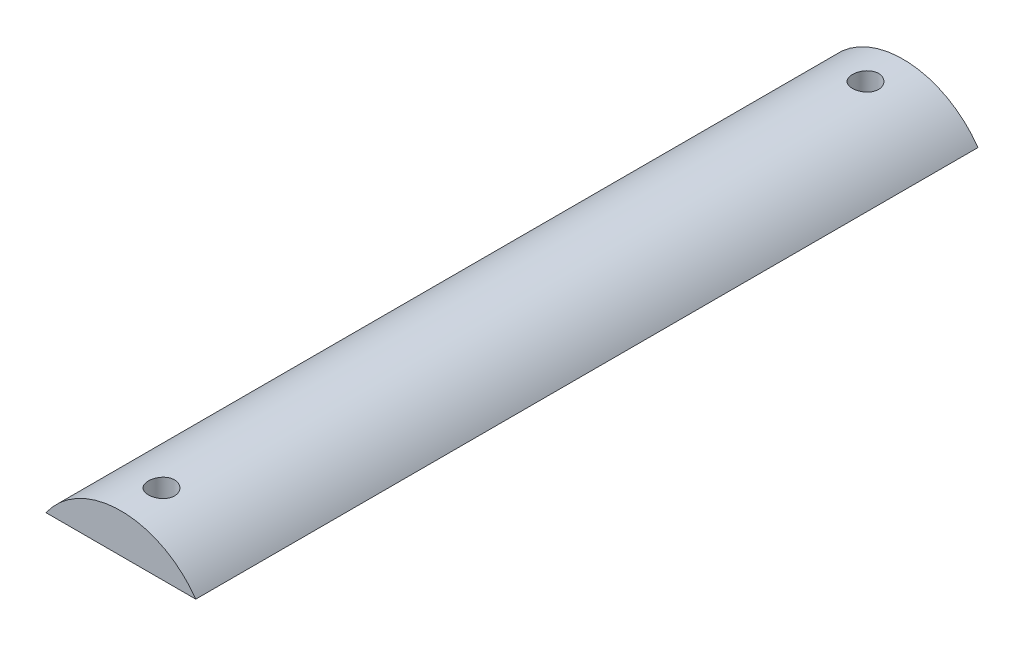
from build123d import *

# Parameters (mm, degrees)
BOSS_EXTRUDE1_DEPTH     = 60
CUT_EXTRUDE1_DEPTH      = 9
CUT_EXTRUDE1_DEPTH_BACK = 1
CUT_EXTRUDE2_DEPTH      = 61.307545133
CUT_EXTRUDE2_DEPTH_BACK = 61.307545133
SKETCH3_R               = 1


with BuildPart() as part:
    # Sketch1 → Boss-Extrude1 (new body)
    with BuildSketch(Plane.XY):
        with BuildLine():
            ThreePointArc((5.744562647, 4), (0, 7), (-5.744562647, 4))
            Line((-5.744562647, 4), (5.744562647, 4))
        make_face()
    extrude(amount=BOSS_EXTRUDE1_DEPTH)

    # Sketch2 → Cut-Extrude1 (cut, two sides: drawn at the far end of the back side and taken through both)
    with BuildSketch(Plane.XZ.offset(-4).offset(-CUT_EXTRUDE1_DEPTH_BACK)):
        Polygon((-2.502029768, 57), (-1.34732923, 55), (0.962071847, 55), (2.116772385, 57), (0.962071847, 59), (-1.34732923, 59), align=None)
        Polygon((-2.502029768, 3), (-1.34732923, 1), (0.962071847, 1), (2.116772385, 3), (0.962071847, 5), (-1.34732923, 5), align=None)
    extrude(amount=CUT_EXTRUDE1_DEPTH + CUT_EXTRUDE1_DEPTH_BACK, mode=Mode.SUBTRACT)

    # Sketch3 → Cut-Extrude2 (cut, two sides: drawn at the far end of the back side and taken through both)
    with BuildSketch(Plane.XZ.offset(-5).offset(-CUT_EXTRUDE2_DEPTH_BACK)):
        with Locations(Location((0, 2.888785773, 0), (0, 0, 270))):
            Circle(SKETCH3_R)
        with Locations(Location((0, 56.888785773, 0), (0, 0, 270))):
            Circle(SKETCH3_R)
    extrude(amount=CUT_EXTRUDE2_DEPTH + CUT_EXTRUDE2_DEPTH_BACK, mode=Mode.SUBTRACT)


solid = part.part
